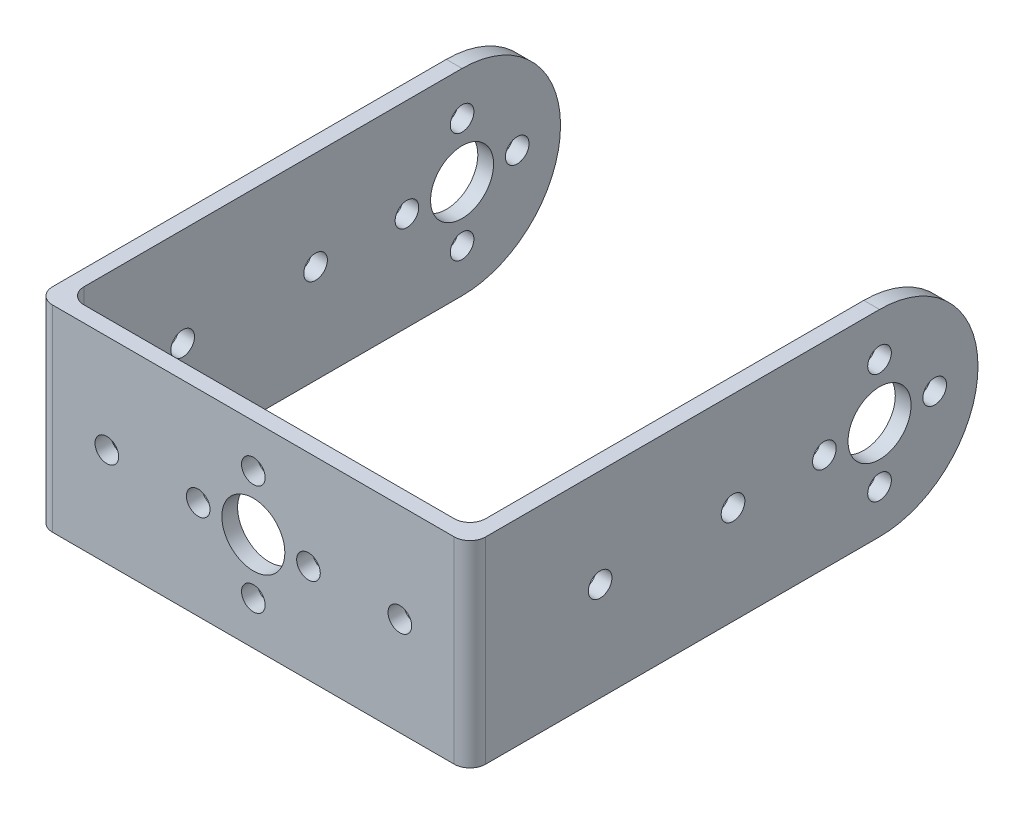
from build123d import *

# Parameters (mm, degrees)
EXTRUDE_1_DEPTH     = 25
SKETCH_2_R          = 1.5
SKETCH_2_R_2        = 4
CUT_EXTRUDE_1_DEPTH = 25
SKETCH_3_R          = 1.5
SKETCH_3_R_2        = 4
CUT_EXTRUDE_2_DEPTH = 25
FILLET_1_R          = 2


with BuildPart() as part:
    # 草图1 → 凸台-拉伸1 (new body)
    with BuildSketch(Plane(origin=(0, 0, 0), x_dir=(1, 0, 0), z_dir=(0, 1, 0))):
        Polygon((0, 0), (27.5, 0), (27.5, 64.5), (25.5, 64.5), (25.5, 2), (0, 2), align=None)
    extrude_1 = extrude(amount=EXTRUDE_1_DEPTH)

    # 草图2 → 切除-拉伸1 (cut)
    with BuildSketch(Plane(origin=(27.5, 0, 0), x_dir=(0, 0, -1), z_dir=(1, 0, 0))):
        with Locations((16.53, 12.5)):
            Circle(SKETCH_2_R)
        with Locations((45, 12.5)):
            Circle(SKETCH_2_R)
        with Locations((52, 12.5)):
            Circle(SKETCH_2_R_2)
        with Locations((52, 19.5)):
            Circle(SKETCH_2_R)
        with Locations((59, 12.5)):
            Circle(SKETCH_2_R)
        with Locations((52, 5.5)):
            Circle(SKETCH_2_R)
        with BuildLine():
            Line((64.5, 25), (52, 25))
            ThreePointArc((52, 25), (60.838834765, 21.338834765), (64.5, 12.5))
            Line((64.5, 12.5), (64.5, 25))
        make_face()
        with BuildLine():
            Line((64.5, 0), (64.5, 12.5))
            ThreePointArc((64.5, 12.5), (60.838834765, 3.661165235), (52, 0))
            Line((52, 0), (64.5, 0))
        make_face()
        with Locations((33.4, 12.5)):
            Circle(SKETCH_2_R)
    cut_extrude_1 = extrude(amount=-CUT_EXTRUDE_1_DEPTH, mode=Mode.SUBTRACT)

    # 镜向1: 凸台-拉伸1, 切除-拉伸1 across plane
    add(extrude_1.mirror(Plane(origin=(0, 25, -2), x_dir=(0, 0, 1), z_dir=(1, 0, 0))))
    add(cut_extrude_1.mirror(Plane(origin=(0, 25, -2), x_dir=(0, 0, 1), z_dir=(1, 0, 0))), mode=Mode.SUBTRACT)

    # 草图3 → 切除-拉伸2 (cut)
    with BuildSketch(Plane.XY):
        with Locations((7, 12.5)):
            Circle(SKETCH_3_R)
        with Locations((0, 19.5)):
            Circle(SKETCH_3_R)
        with Locations((-7, 12.5)):
            Circle(SKETCH_3_R)
        with Locations((0, 5.5)):
            Circle(SKETCH_3_R)
        with Locations((18.6, 12.5)):
            Circle(SKETCH_3_R)
        with Locations((-18.6, 12.5)):
            Circle(SKETCH_3_R)
        with Locations((0, 12.5)):
            Circle(SKETCH_3_R_2)
    extrude(amount=-CUT_EXTRUDE_2_DEPTH, mode=Mode.SUBTRACT)

    # 圆角1
    fillet_1_edges = [part.edges().sort_by_distance(p)[0] for p in [
        (25.5, 12.5, -2),
        (27.5, 12.5, 0),
        (-25.5, 12.5, -2),
        (-27.5, 12.5, 0),
    ]]
    fillet(fillet_1_edges, radius=FILLET_1_R)


solid = part.part
